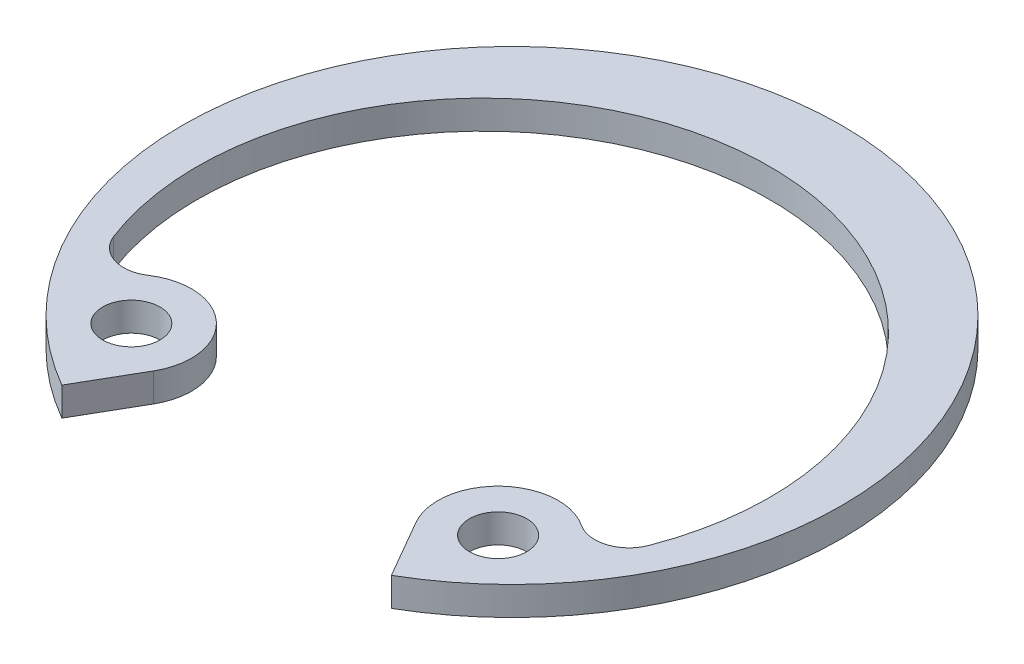
from build123d import *

# Parameters (mm, degrees)
SKETCH_1_R      = 1
EXTRUDE_1_DEPTH = 1


with BuildPart() as part:
    # 草图1 → 凸台-拉伸1 (new body)
    with BuildSketch(Plane(origin=(0, 0, 0), x_dir=(1, 0, 0), z_dir=(0, 1, 0))):
        with BuildLine():
            Line((-5.75, -9.959292144), (-4.58121163, -7.934891304))
            ThreePointArc((-4.58121163, -7.934891304), (-4.960583519, -5.355685993), (-7.558022947, -5.1331293))
            ThreePointArc((-7.558022947, -5.1331293), (-8.587203168, -5.274503777), (-9.341056075, -4.559727963))
            ThreePointArc((-9.341056075, -4.559727963), (0, 9), (9.341056075, -4.559727963))
            ThreePointArc((9.341056075, -4.559727963), (8.587203168, -5.274503777), (7.558022947, -5.1331293))
            ThreePointArc((7.558022947, -5.1331293), (4.960583519, -5.355685993), (4.58121163, -7.934891304))
            Line((4.58121163, -7.934891304), (5.75, -9.959292144))
            ThreePointArc((5.75, -9.959292144), (0, 11.5), (-5.75, -9.959292144))
        make_face()
        with Locations(Location((-6.399864978, -6.884891304, 0), (0, 0, 270))):
            Circle(SKETCH_1_R, mode=Mode.SUBTRACT)
        with Locations(Location((6.399864978, -6.884891304, 0), (0, 0, 270))):
            Circle(SKETCH_1_R, mode=Mode.SUBTRACT)
    extrude(amount=EXTRUDE_1_DEPTH)


solid = part.part
